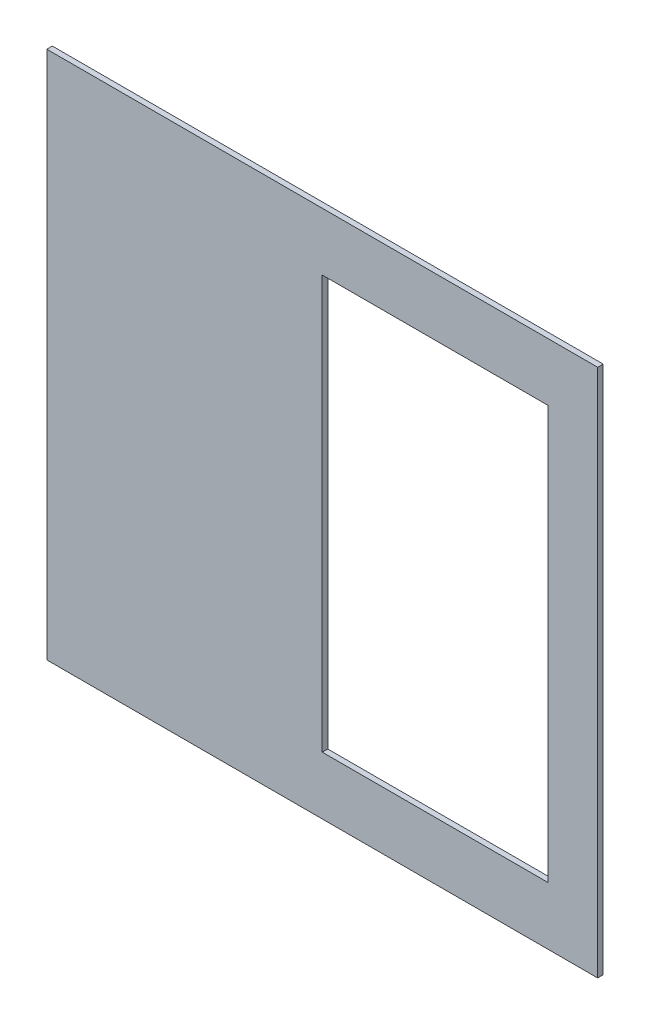
from build123d import *

# Parameters (mm, degrees)
SKETCH1_W           = 635
SKETCH1_H           = 609.6
BOSS_EXTRUDE1_DEPTH = 3.175
SKETCH2_W           = 260.35
SKETCH2_H           = 476.25
CUT_EXTRUDE1_DEPTH  = 441.169981371


with BuildPart() as part:
    # Sketch1 → Boss-Extrude1 (new, symmetric)
    with BuildSketch(Plane.XY):
        Rectangle(SKETCH1_W, SKETCH1_H)
    extrude(amount=BOSS_EXTRUDE1_DEPTH, both=True)

    # Sketch2 → Cut-Extrude1 (cut, through all)
    with BuildSketch(Plane.XY.offset(3.175)):
        with Locations((130.175, 0)):
            Rectangle(SKETCH2_W, SKETCH2_H)
    extrude(amount=-CUT_EXTRUDE1_DEPTH, mode=Mode.SUBTRACT)


solid = part.part
